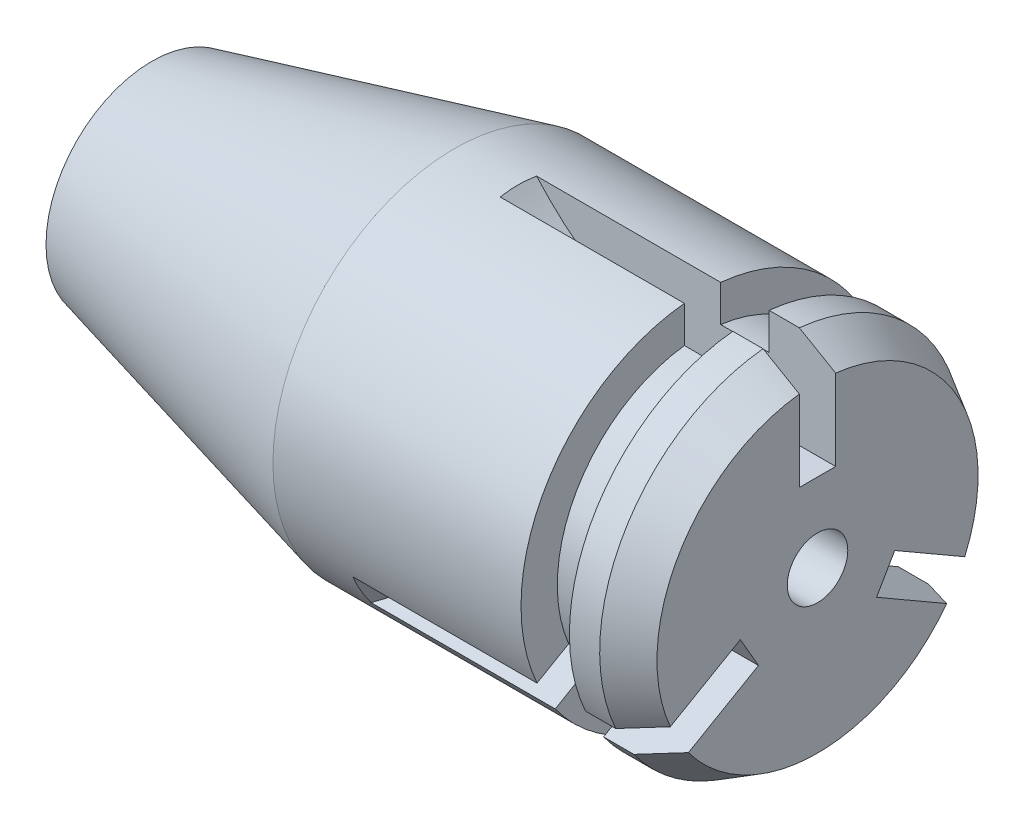
from build123d import *

# Parameters (mm, degrees)
CUT_EXTRUDE1_DEPTH           = 3
CIRPATTERN1_COUNT            = 3
M10_TAPPED_HOLE1_D           = 8.5
M10_TAPPED_HOLE1_DEPTH       = 24.5
M10_TAPPED_HOLE1_CBORE_D     = 10
M10_TAPPED_HOLE1_CBORE_DEPTH = 20
M10_TAPPED_HOLE1_TIP         = 2.553657631


with BuildPart() as part:
    # Sketch1 → Revolve1 (revolve)
    with BuildSketch(Plane.XY, mode=Mode.PRIVATE) as revolve1_sk:
        Polygon((0, 13.5), (0, 17.5), (50, 30), (91, 30), (91, 24), (99, 24), (99, 30), (104, 30), (110, 26.535898385), (110, 0), (17.216878365, 0), (10, 12.5), (1, 12.5), align=None)
    revolve(revolve1_sk.sketch.rotate(Axis((0, 0, 0), (1, 0, 0)), 90), axis=Axis((0, 0, 0), (1, 0, 0)))

    # Sketch2 → Cut-Extrude1 (cut, symmetric)
    with BuildSketch(Plane.XY):
        with BuildLine():
            Line((98, 13), (110, 13))
            Line((110, 13), (110, 30))
            Line((110, 30), (60.436720058, 30))
            ThreePointArc((60.436720058, 30), (77.384471872, 17.447832104), (98, 13))
        make_face()
    cut_extrude1 = extrude(amount=CUT_EXTRUDE1_DEPTH, both=True, mode=Mode.SUBTRACT)

    # CirPattern1: Cut-Extrude1 ×3 about axis
    cirpattern1_axis = Axis((0, 0, 0), (1, 0, 0))
    for i in range(1, CIRPATTERN1_COUNT):
        add(cut_extrude1.rotate(cirpattern1_axis, i * 360 / CIRPATTERN1_COUNT), mode=Mode.SUBTRACT)

    # M10 Tapped Hole1
    with Locations(Plane(origin=(110, 0, 0), x_dir=(0, 0, -1), z_dir=(1, 0, 0))):
        with Locations((0, 0)):
            CounterBoreHole(M10_TAPPED_HOLE1_D / 2, M10_TAPPED_HOLE1_CBORE_D / 2, M10_TAPPED_HOLE1_CBORE_DEPTH, depth=M10_TAPPED_HOLE1_DEPTH)
            with Locations((0, 0, -(M10_TAPPED_HOLE1_DEPTH + M10_TAPPED_HOLE1_TIP / 2))):  # 118° drill point
                Cone(0, M10_TAPPED_HOLE1_D / 2, M10_TAPPED_HOLE1_TIP, mode=Mode.SUBTRACT)


solid = part.part
